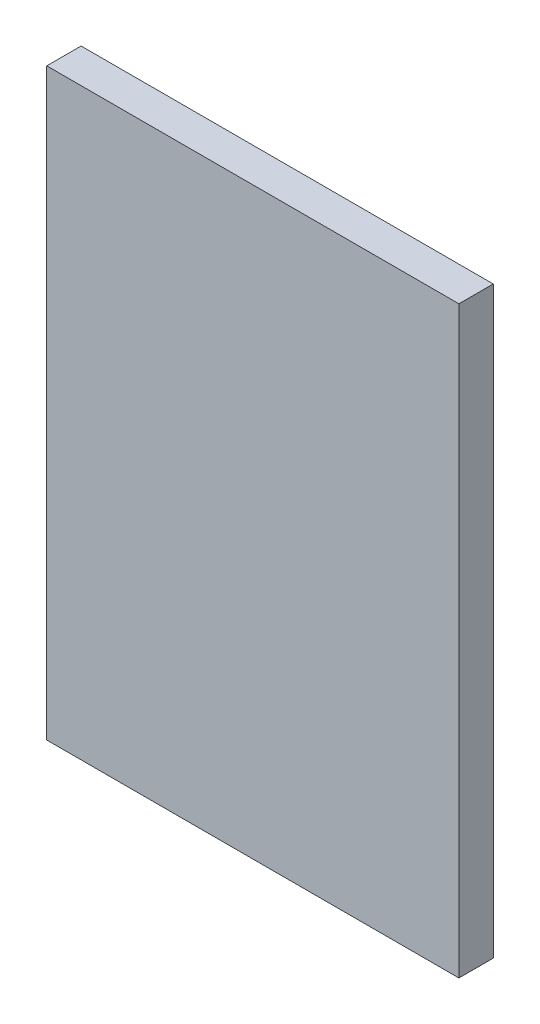
from build123d import *

# Parameters (mm, degrees)
SKETCH1_W           = 304.8
SKETCH1_H           = 431.8
BOSS_EXTRUDE1_DEPTH = 25.4


with BuildPart() as part:
    # Sketch1 → Boss-Extrude1 (new body)
    with BuildSketch(Plane.XY):
        Rectangle(SKETCH1_W, SKETCH1_H)
    extrude(amount=BOSS_EXTRUDE1_DEPTH)


solid = part.part
